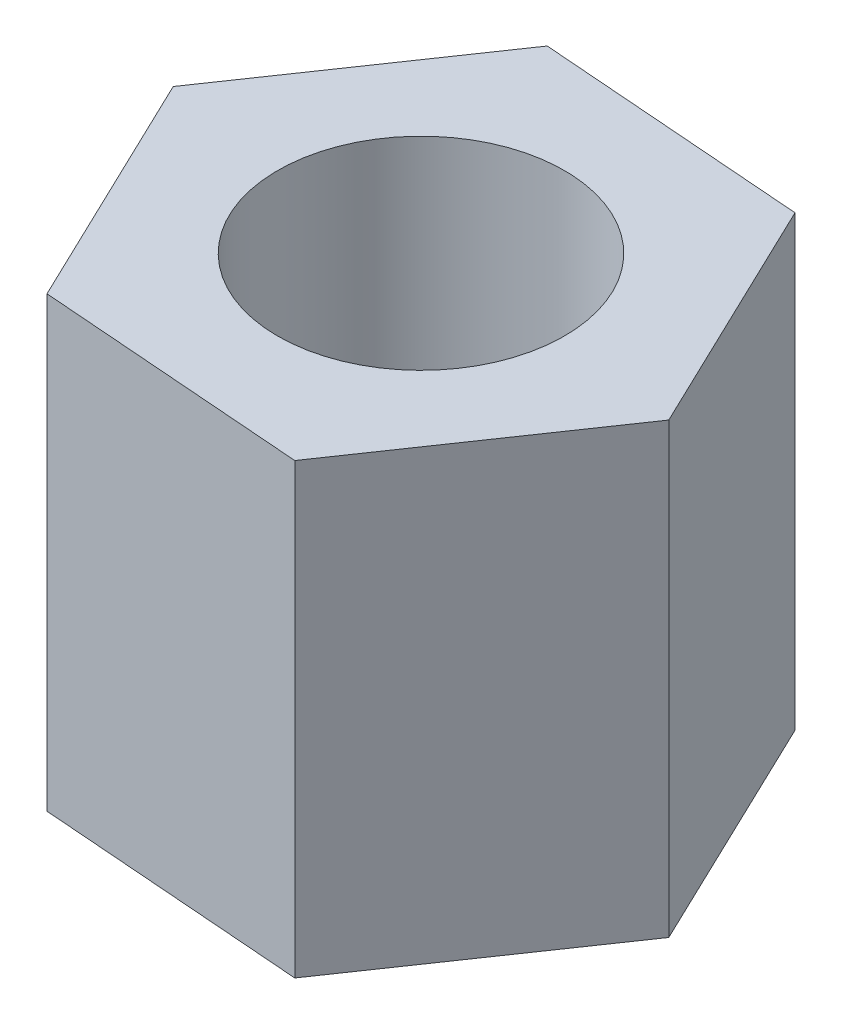
from build123d import *

# Parameters (mm, degrees)
SKETCH_1_R      = 1.6
EXTRUDE_1_DEPTH = 5


with BuildPart() as part:
    # 草图1 → 凸台-拉伸1 (new body)
    with BuildSketch(Plane(origin=(0, 0, 0), x_dir=(1, 0, 0), z_dir=(0, 1, 0))):
        Polygon((1.29843897, -2.70691514), (2.993476762, -0.228976437), (1.695037792, 2.477938703), (-1.29843897, 2.70691514), (-2.993476762, 0.228976437), (-1.695037792, -2.477938703), align=None)
        with Locations(Location((0, 0, 0), (0, 0, 270))):
            Circle(SKETCH_1_R, mode=Mode.SUBTRACT)
    extrude(amount=EXTRUDE_1_DEPTH)


solid = part.part
